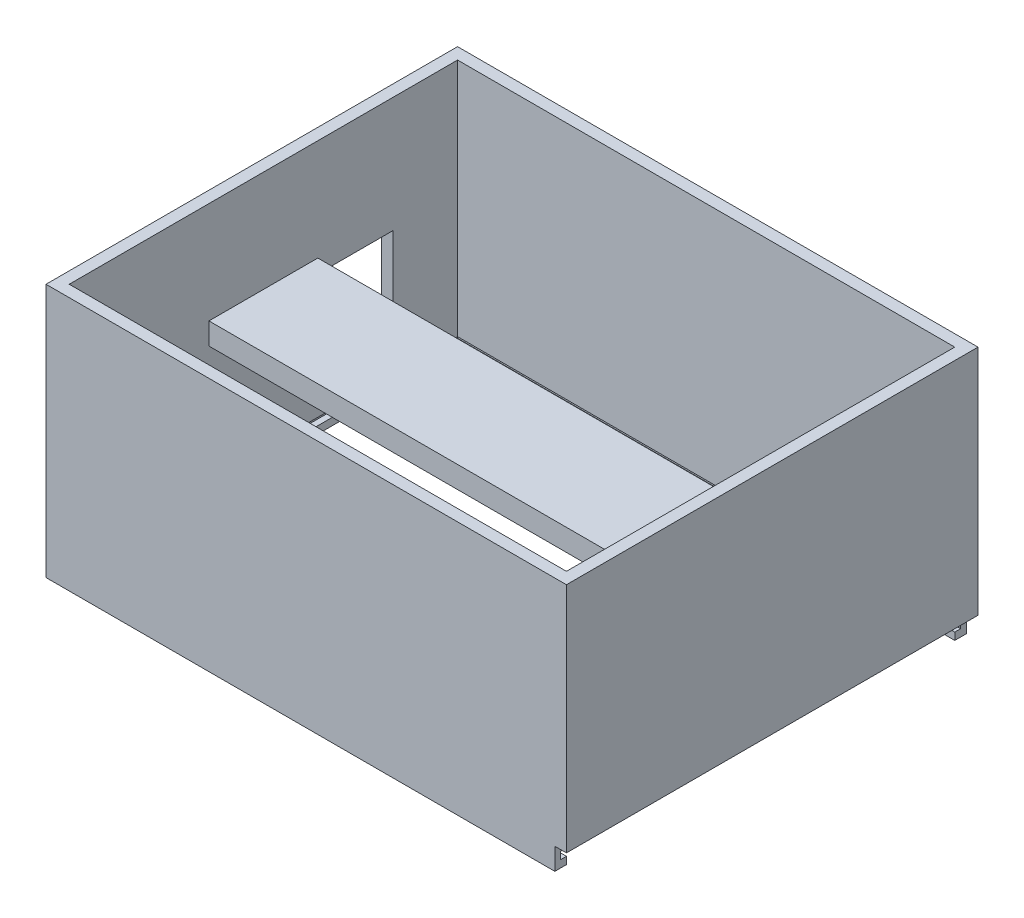
from build123d import *

# Parameters (mm, degrees)
SKETCH1_W           = 71.7
SKETCH1_H           = 56.7
SKETCH1_W_2         = 68.5
SKETCH1_H_2         = 53.5
BOSS_EXTRUDE1_DEPTH = 32
SKETCH2_W           = 15
SKETCH2_H           = 3
BOSS_EXTRUDE2_DEPTH = 70
SKETCH3_W           = 12.3
SKETCH3_H           = 12
SKETCH3_W_2         = 9.3
SKETCH3_H_2         = 11
CUT_EXTRUDE1_DEPTH  = 1.6
SKETCH3_2_W         = 12.3
SKETCH3_2_H         = 12
SKETCH3_2_W_2       = 9.3
SKETCH3_2_H_2       = 11
CUT_EXTRUDE2_DEPTH  = 18
BOSS_EXTRUDE3_DEPTH = 3
SKETCH5_W           = 55.1
SKETCH5_H           = 1
CUT_EXTRUDE3_DEPTH  = 69.3


with BuildPart() as part:
    # Sketch1 → Boss-Extrude1 (new body)
    with BuildSketch(Plane(origin=(0, 0, 0), x_dir=(1, 0, 0), z_dir=(0, 1, 0))):
        with Locations((1.229030624, -8.245503616)):
            Rectangle(SKETCH1_W, SKETCH1_H)
        with Locations((1.229030624, -8.245503616)):
            Rectangle(SKETCH1_W_2, SKETCH1_H_2, mode=Mode.SUBTRACT)
    extrude(amount=BOSS_EXTRUDE1_DEPTH)

    # Sketch2 → Boss-Extrude2 (add)
    with BuildSketch(Plane(origin=(-33.020969376, 0, 0), x_dir=(0, 0, -1), z_dir=(1, 0, 0))):
        with Locations((-8.245503616, 16.5)):
            Rectangle(SKETCH2_W, SKETCH2_H)
    extrude(amount=BOSS_EXTRUDE2_DEPTH)

    # Sketch3 → Cut-Extrude1 (cut)
    with BuildSketch(Plane(origin=(-33.020969376, 0, 0), x_dir=(0, 0, -1), z_dir=(1, 0, 0))):
        with Locations((3.454496384, 10.1)):
            Rectangle(SKETCH3_W, SKETCH3_H)
        with Locations((-27.245503616, 9.6)):
            Rectangle(SKETCH3_W_2, SKETCH3_H_2)
    extrude(amount=-CUT_EXTRUDE1_DEPTH, mode=Mode.SUBTRACT)

    # Sketch3<2> → Cut-Extrude2 (cut)
    with BuildSketch(Plane(origin=(-33.020969376, 0, 0), x_dir=(0, 0, -1), z_dir=(1, 0, 0))):
        with Locations((3.454496384, 10.1)):
            Rectangle(SKETCH3_2_W, SKETCH3_2_H)
        with Locations((-27.245503616, 9.6)):
            Rectangle(SKETCH3_2_W_2, SKETCH3_2_H_2)
    extrude(amount=CUT_EXTRUDE2_DEPTH, mode=Mode.SUBTRACT)

    # Sketch4 → Boss-Extrude3 (add)
    with BuildSketch(Plane.XZ):
        Polygon((35.479030624, 36.595503616), (35.479030624, 34.995503616), (-33.020969376, 34.995503616), (-33.020969376, -18.504496384), (35.479030624, -18.504496384), (35.479030624, -20.104496384), (-34.620969376, -20.104496384), (-34.620969376, 36.595503616), align=None)
    extrude(amount=BOSS_EXTRUDE3_DEPTH)

    # Sketch5 → Cut-Extrude3 (cut)
    with BuildSketch(Plane(origin=(35.479030624, 0, 0), x_dir=(0, 0, -1), z_dir=(1, 0, 0))):
        with Locations((-8.245503616, -1.5)):
            Rectangle(SKETCH5_W, SKETCH5_H)
    extrude(amount=-CUT_EXTRUDE3_DEPTH, mode=Mode.SUBTRACT)


solid = part.part
